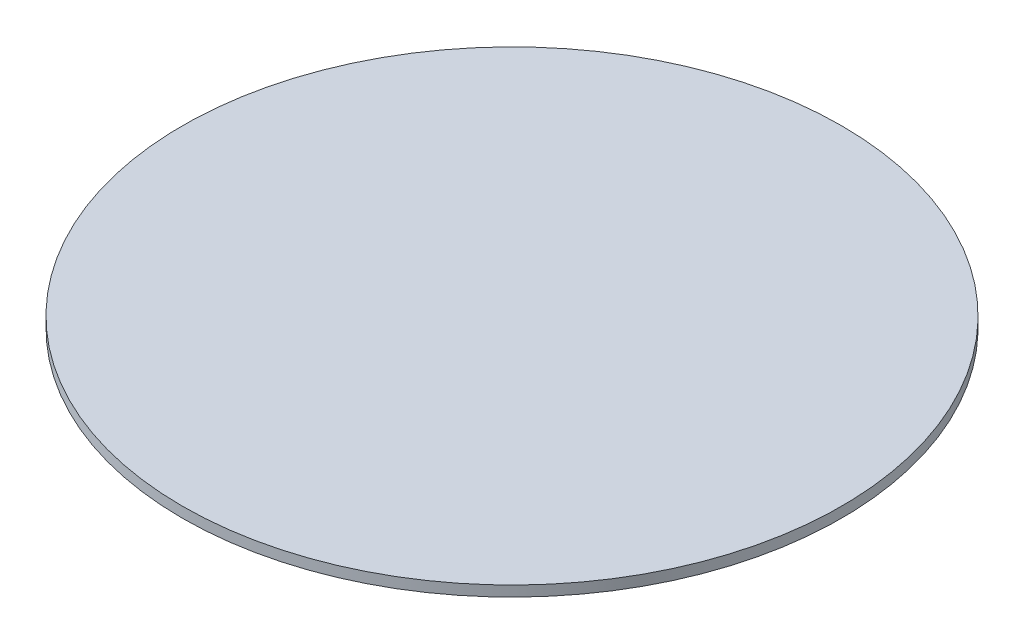
from build123d import *

# Parameters (mm, degrees)
SKETCH1_R           = 100
BOSS_EXTRUDE1_DEPTH = 3.175


with BuildPart() as part:
    # Sketch1 → Boss-Extrude1 (new body)
    with BuildSketch(Plane(origin=(0, 0, 0), x_dir=(1, 0, 0), z_dir=(0, 1, 0))):
        with Locations(Location((0, 0, 0), (0, 0, 270))):
            Circle(SKETCH1_R)
    extrude(amount=BOSS_EXTRUDE1_DEPTH)


solid = part.part
